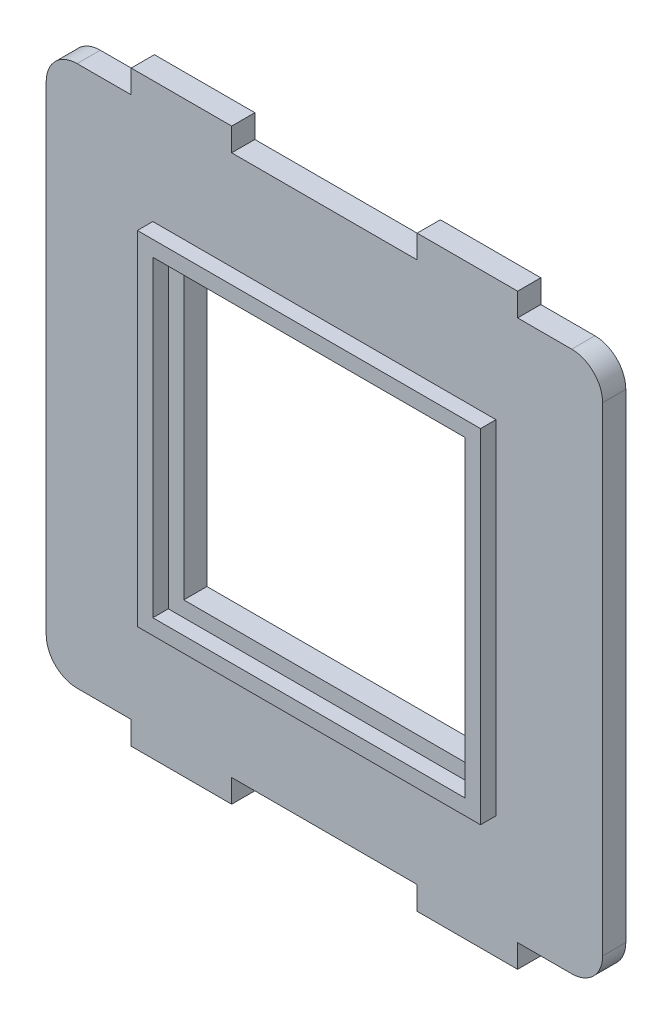
from build123d import *

# Parameters (mm, degrees)
BOSS_EXTRUDE1_DEPTH = 1.5
SKETCH2_W           = 22.2
SKETCH2_H           = 22.2
SKETCH2_W_2         = 20.2
SKETCH2_H_2         = 20.2
BOSS_EXTRUDE2_DEPTH = 1
SKETCH3_W           = 18.2
SKETCH3_H           = 18.2
CUT_EXTRUDE1_DEPTH  = 27.215453458
FILLET1_R           = 2


with BuildPart() as part:
    # Sketch1 → Boss-Extrude1 (new body)
    with BuildSketch(Plane.XY):
        Polygon((-18, -17.5), (-12.5, -17.5), (-12.5, -19), (-6, -19), (-6, -17.5), (6, -17.5), (6, -19), (12.5, -19), (12.5, -17.5), (18, -17.5), (18, 17.5), (12.5, 17.5), (12.5, 19), (6, 19), (6, 17.5), (-6, 17.5), (-6, 19), (-12.5, 19), (-12.5, 17.5), (-18, 17.5), align=None)
    extrude(amount=BOSS_EXTRUDE1_DEPTH)

    # Sketch2 → Boss-Extrude2 (add)
    with BuildSketch(Plane.XY.offset(1.5)):
        Rectangle(SKETCH2_W, SKETCH2_H)
        Rectangle(SKETCH2_W_2, SKETCH2_H_2, mode=Mode.SUBTRACT)
    extrude(amount=BOSS_EXTRUDE2_DEPTH)

    # Sketch3 → Cut-Extrude1 (cut, through all)
    with BuildSketch(Plane.XY.offset(1.5)):
        Rectangle(SKETCH3_W, SKETCH3_H)
    extrude(amount=-CUT_EXTRUDE1_DEPTH, mode=Mode.SUBTRACT)

    # Fillet1
    fillet1_edges = [part.edges().sort_by_distance(p)[0] for p in [
        (18, 17.5, 0.75),
        (18, -17.5, 0.75),
        (-18, -17.5, 0.75),
        (-18, 17.5, 0.75),
    ]]
    fillet(fillet1_edges, radius=FILLET1_R)


solid = part.part
